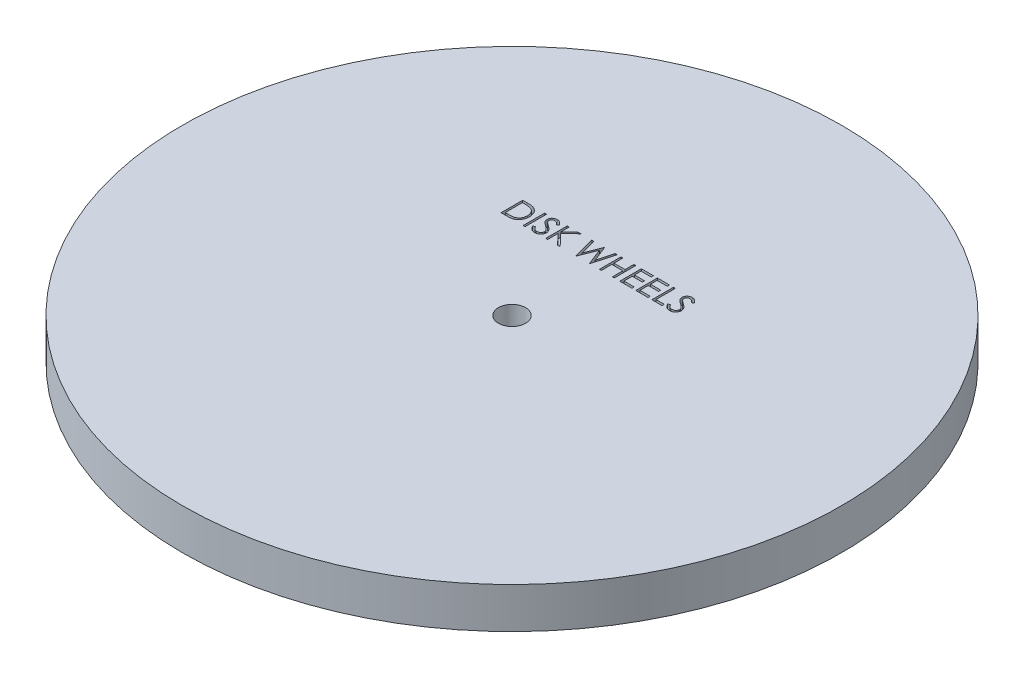
from build123d import *

# Parameters (mm, degrees)
SKETCH1_R           = 48.5
BOSS_EXTRUDE1_DEPTH = 6
SKETCH2_W           = 0.284935897
SKETCH2_H           = 3.175
CUT_EXTRUDE1_DEPTH  = 1
SKETCH3_R           = 2
CUT_EXTRUDE2_DEPTH  = 10


with BuildPart() as part:
    # Sketch1 → Boss-Extrude1 (new body)
    with BuildSketch(Plane(origin=(0, 0, 0), x_dir=(1, 0, 0), z_dir=(0, 1, 0))):
        with Locations(Location((0, 0, 0), (0, 0, 270))):
            Circle(SKETCH1_R)
    extrude(amount=BOSS_EXTRUDE1_DEPTH)

    # Sketch2 → Cut-Extrude1 (cut)
    # profile 1 of 10: a face of its own
    with BuildSketch(Plane(origin=(0, 6, 0), x_dir=(1, 0, 0), z_dir=(0, 1, 0))):
        with BuildLine():
            Line((-13.899118378, 12.298286199), (-13.899118378, 15.473286199))
            Line((-13.899118378, 15.473286199), (-13.258012609, 15.473286199))
            add(Edge.make_bspline(
                [(-13.258012609, 15.473286199), (-13.202251455, 15.472884725), (-13.094521197, 15.472109079), (-12.938844191, 15.467191102), (-12.794804635, 15.45849118), (-12.662876255, 15.445818824), (-12.54269687, 15.430258572), (-12.43460299, 15.410754634), (-12.338035689, 15.387723936), (-12.278645554, 15.368088421), (-12.250560686, 15.358803026)],
                knots=[0, 0, 0, 0, 1.314313732, 2.53924729, 3.670748893, 4.714932338, 5.66265055, 6.526160246, 7.303039223, 8, 8, 8, 8], degree=3))
            add(Edge.make_bspline(
                [(-12.250560686, 15.358803026), (-12.213826172, 15.344805171), (-12.141190162, 15.317126888), (-12.037769415, 15.2649151), (-11.940409979, 15.2057575), (-11.848589754, 15.139576111), (-11.764406148, 15.064497023), (-11.684570413, 14.983709524), (-11.612348485, 14.894275815), (-11.546210245, 14.798050648), (-11.486578611, 14.696167572), (-11.434745232, 14.588820723), (-11.391697681, 14.476555256), (-11.355962397, 14.359683372), (-11.327798824, 14.237948086), (-11.308583786, 14.11120765), (-11.295910103, 13.979962957), (-11.294636428, 13.890904694), (-11.293990173, 13.845717088)],
                knots=[0, 0, 0, 0, 0.984719456, 1.947108742, 2.898477687, 3.838006223, 4.779231079, 5.722358779, 6.681677486, 7.655904652, 8.64651281, 9.637519902, 10.640069247, 11.656948941, 12.698408672, 13.768548281, 14.867775369, 16, 16, 16, 16], degree=3))
            add(Edge.make_bspline(
                [(-11.293990173, 13.845717088), (-11.294560736, 13.806472965), (-11.295685091, 13.729138321), (-11.30578097, 13.61516408), (-11.320455203, 13.504571054), (-11.343173869, 13.397885883), (-11.370753291, 13.294173857), (-11.406099343, 13.194540321), (-11.446590115, 13.098071294), (-11.49380679, 13.006071155), (-11.545642189, 12.91890981), (-11.601269771, 12.836744867), (-11.660630201, 12.760748773), (-11.724289526, 12.690691389), (-11.791425097, 12.626678329), (-11.862476454, 12.568174858), (-11.937626936, 12.516325697), (-12.016539949, 12.469093392), (-12.10151758, 12.427890641), (-12.194169402, 12.393029132), (-12.294890542, 12.364139702), (-12.403433774, 12.340036104), (-12.519986643, 12.320915979), (-12.644663419, 12.308101323), (-12.777272546, 12.299435449), (-12.86833088, 12.298676721), (-12.915199107, 12.298286199)],
                knots=[0, 0, 0, 0, 1.105936401, 2.179363191, 3.223086493, 4.248585256, 5.251745608, 6.245858792, 7.225916811, 8.198733463, 9.158002045, 10.082870192, 10.993790845, 11.873723703, 12.748670949, 13.606408763, 14.465103618, 15.319838547, 16.196477973, 17.123216899, 18.106603292, 19.147568657, 20.255746949, 21.433717677, 22.679120308, 24, 24, 24, 24], degree=3))
            Line((-12.915199107, 12.298286199), (-13.899118378, 12.298286199))
        make_face()
        with BuildLine():
            Line((-13.61418248, 12.623927225), (-13.249744379, 12.623927225))
            add(Edge.make_bspline(
                [(-13.249744379, 12.623927225), (-13.1973765, 12.624152283), (-13.09665389, 12.624585154), (-12.951821279, 12.628383545), (-12.819487826, 12.63459016), (-12.699634742, 12.643276124), (-12.592329699, 12.654768367), (-12.49734844, 12.667581672), (-12.415002313, 12.683545074), (-12.365173467, 12.698014873), (-12.342147224, 12.704701463)],
                knots=[0, 0, 0, 0, 1.375205317, 2.645023457, 3.804390687, 4.853969522, 5.800190428, 6.637939096, 7.370582563, 8, 8, 8, 8], degree=3))
            add(Edge.make_bspline(
                [(-12.342147224, 12.704701463), (-12.313165496, 12.714908234), (-12.255894267, 12.735077987), (-12.173452139, 12.77186958), (-12.096565428, 12.8154506), (-12.023894191, 12.863894091), (-11.956469296, 12.918908679), (-11.893491705, 12.979298076), (-11.835088214, 13.045369622), (-11.781862234, 13.117041311), (-11.734229701, 13.193867054), (-11.6929808, 13.275091568), (-11.656829768, 13.359824889), (-11.628455616, 13.449368197), (-11.606216479, 13.542920985), (-11.590464227, 13.640489836), (-11.580653727, 13.742056527), (-11.579509413, 13.811137383), (-11.57892607, 13.846353106)],
                knots=[0, 0, 0, 0, 0.998632004, 1.973411704, 2.929992603, 3.868527914, 4.809262121, 5.754881198, 6.702106254, 7.672490631, 8.653608572, 9.636854334, 10.631411391, 11.644891563, 12.686317036, 13.754757253, 14.855430412, 16, 16, 16, 16], degree=3))
            add(Edge.make_bspline(
                [(-11.57892607, 13.846353106), (-11.579391695, 13.88348562), (-11.58030642, 13.956432773), (-11.59180383, 14.06346719), (-11.608605526, 14.166410351), (-11.632902156, 14.265269143), (-11.663863739, 14.360236434), (-11.702503164, 14.450786989), (-11.74665074, 14.53787712), (-11.799177338, 14.619496724), (-11.856704341, 14.69668833), (-11.920547131, 14.767404575), (-11.989691409, 14.831806547), (-12.063383023, 14.890897209), (-12.14369882, 14.942299258), (-12.228746811, 14.988279319), (-12.31977467, 15.027300877), (-12.383104758, 15.048055274), (-12.415289251, 15.058602705)],
                knots=[0, 0, 0, 0, 1.122418816, 2.205001699, 3.251619955, 4.274784885, 5.280384055, 6.268708349, 7.249350384, 8.229342522, 9.199999885, 10.157847722, 11.105861043, 12.055065948, 13.010012805, 13.98527497, 14.976112212, 16, 16, 16, 16], degree=3))
            add(Edge.make_bspline(
                [(-12.415289251, 15.058602705), (-12.441914934, 15.065965465), (-12.498528441, 15.081620712), (-12.590911383, 15.098698014), (-12.694883697, 15.113760667), (-12.810906998, 15.126513317), (-12.938849029, 15.135663958), (-13.078808188, 15.142532222), (-13.230844972, 15.147164667), (-13.336239128, 15.147480995), (-13.390940293, 15.147645173)],
                knots=[0, 0, 0, 0, 0.674548936, 1.434276114, 2.292660221, 3.240891867, 4.284742987, 5.42552168, 6.663806718, 8, 8, 8, 8], degree=3))
            Line((-13.390940293, 15.147645173), (-13.61418248, 15.147645173))
            Line((-13.61418248, 15.147645173), (-13.61418248, 12.623927225))
        make_face(mode=Mode.SUBTRACT)
    # profile 2 of 10: a face of its own
    with BuildSketch(Plane(origin=(0, 6, 0), x_dir=(1, 0, 0), z_dir=(0, 1, 0))):
        with Locations((-10.500240172, 13.885786199)):
            Rectangle(SKETCH2_W, SKETCH2_H)
    # profile 3 of 10: a face of its own
    with BuildSketch(Plane(origin=(0, 6, 0), x_dir=(1, 0, 0), z_dir=(0, 1, 0))):
        with BuildLine():
            Line((-9.869310686, 12.910771175), (-9.600911246, 13.071683635))
            add(Edge.make_bspline(
                [(-9.600911246, 13.071683635), (-9.575948274, 13.029896657), (-9.528120182, 12.94983442), (-9.448335735, 12.841650341), (-9.365665166, 12.749700384), (-9.27949627, 12.674519462), (-9.190355017, 12.6153294), (-9.097659483, 12.573417376), (-9.00172204, 12.547277169), (-8.936431502, 12.544102091), (-8.903835926, 12.542516968)],
                knots=[0, 0, 0, 0, 1.272034388, 2.437168799, 3.508375237, 4.49857839, 5.41946034, 6.295179144, 7.148887113, 8, 8, 8, 8], degree=3))
            add(Edge.make_bspline(
                [(-8.903835926, 12.542516968), (-8.87599856, 12.543292278), (-8.820810916, 12.544829332), (-8.739565167, 12.559598346), (-8.660660246, 12.58228792), (-8.58572241, 12.614782622), (-8.515785674, 12.65409682), (-8.454456743, 12.701582281), (-8.401437769, 12.754746481), (-8.358068073, 12.81405789), (-8.324794041, 12.877845589), (-8.299219807, 12.943319487), (-8.28502749, 13.011508117), (-8.282889578, 13.057419037), (-8.281810686, 13.080587882)],
                knots=[0, 0, 0, 0, 1.095163259, 2.171163733, 3.241058638, 4.321873601, 5.38011039, 6.391990106, 7.366004449, 8.327778327, 9.272591725, 10.192022065, 11.087607919, 12, 12, 12, 12], degree=3))
            add(Edge.make_bspline(
                [(-8.281810686, 13.080587882), (-8.283148096, 13.107022795), (-8.285866856, 13.160761112), (-8.308846127, 13.240045083), (-8.344995087, 13.3185062), (-8.378344056, 13.367039491), (-8.395657841, 13.392236519)],
                knots=[0, 0, 0, 0, 0.938893495, 1.908633276, 2.914225137, 4, 4, 4, 4], degree=3))
            add(Edge.make_bspline(
                [(-8.395657841, 13.392236519), (-8.409873327, 13.410421852), (-8.439716961, 13.448599684), (-8.491022704, 13.505427862), (-8.551226251, 13.564045999), (-8.618267333, 13.626692429), (-8.694588064, 13.690453502), (-8.777798023, 13.758369725), (-8.870021667, 13.827858299), (-8.934700496, 13.874460555), (-8.968073706, 13.898506551)],
                knots=[0, 0, 0, 0, 0.722233717, 1.516239348, 2.393582979, 3.351407094, 4.387010283, 5.505090956, 6.712668013, 8, 8, 8, 8], degree=3))
            add(Edge.make_bspline(
                [(-8.968073706, 13.898506551), (-9.001478332, 13.922299627), (-9.065345431, 13.967790177), (-9.154661431, 14.035303634), (-9.234530336, 14.097029145), (-9.304597159, 14.153547784), (-9.364831079, 14.204867218), (-9.415706744, 14.250494635), (-9.45592815, 14.291664008), (-9.478294284, 14.318371511), (-9.488336126, 14.330362521)],
                knots=[0, 0, 0, 0, 1.452282411, 2.77665338, 3.964542531, 5.026858415, 5.96415736, 6.766646006, 7.446254459, 8, 8, 8, 8], degree=3))
            add(Edge.make_bspline(
                [(-9.488336126, 14.330362521), (-9.502371935, 14.349050604), (-9.529975237, 14.385803229), (-9.566411542, 14.443247921), (-9.59738064, 14.502051883), (-9.621657898, 14.562373132), (-9.642101468, 14.623364817), (-9.655851877, 14.685822733), (-9.66446193, 14.749466623), (-9.66534366, 14.792296012), (-9.665785045, 14.813735918)],
                knots=[0, 0, 0, 0, 1.068054152, 2.10047183, 3.106115577, 4.101338837, 5.06977816, 6.043150881, 7.020423561, 8, 8, 8, 8], degree=3))
            add(Edge.make_bspline(
                [(-9.665785045, 14.813735918), (-9.664601034, 14.847327214), (-9.662258319, 14.913791815), (-9.64244585, 15.010884068), (-9.61117401, 15.103581746), (-9.567363648, 15.190967121), (-9.510887335, 15.270764832), (-9.445531344, 15.343892781), (-9.367688067, 15.405368566), (-9.282278187, 15.459082362), (-9.188791336, 15.501124737), (-9.090828159, 15.53283934), (-8.988232958, 15.550809167), (-8.918742971, 15.553387961), (-8.883483362, 15.554696455)],
                knots=[0, 0, 0, 0, 1.005424448, 1.989358655, 2.955360095, 3.929531133, 4.905563448, 5.876582895, 6.856512386, 7.866279853, 8.892233794, 9.918561126, 10.94386622, 12, 12, 12, 12], degree=3))
            add(Edge.make_bspline(
                [(-8.883483362, 15.554696455), (-8.846069071, 15.553405998), (-8.771663988, 15.55083969), (-8.662217913, 15.528526215), (-8.556843549, 15.491604891), (-8.472077159, 15.44970518), (-8.405735297, 15.407857396), (-8.355141461, 15.369739412), (-8.303872059, 15.325856278), (-8.251513538, 15.276091105), (-8.198953082, 15.219987266), (-8.145410379, 15.157928998), (-8.090760221, 15.090295551), (-8.05560312, 15.042013326), (-8.037579916, 15.017261559)],
                knots=[0, 0, 0, 0, 1.286793592, 2.559021753, 3.825965368, 5.121522368, 5.803751409, 6.523245864, 7.299691795, 8.125521123, 9.008227632, 9.944561021, 10.946284179, 12, 12, 12, 12], degree=3))
            Line((-8.037579916, 15.017261559), (-8.295167056, 14.822004148))
            add(Edge.make_bspline(
                [(-8.295167056, 14.822004148), (-8.310720866, 14.842041745), (-8.340673868, 14.880629474), (-8.386148474, 14.934669167), (-8.429009747, 14.984032688), (-8.47123761, 15.026908911), (-8.510601833, 15.065645846), (-8.548808007, 15.098810769), (-8.585306311, 15.12672863), (-8.631313794, 15.156522431), (-8.689114867, 15.186055831), (-8.761672268, 15.21104678), (-8.83749696, 15.226064586), (-8.889140269, 15.22805022), (-8.915284243, 15.22905543)],
                knots=[0, 0, 0, 0, 1.181633172, 2.275549214, 3.290209073, 4.226197932, 5.078386478, 5.862611352, 6.581680152, 7.217281963, 8.414376989, 9.595101626, 10.782541182, 12, 12, 12, 12], degree=3))
            add(Edge.make_bspline(
                [(-8.915284243, 15.22905543), (-8.948083374, 15.227956245), (-9.011333409, 15.22583657), (-9.101131694, 15.202686298), (-9.181952612, 15.16623561), (-9.251396725, 15.11514988), (-9.309215268, 15.054624408), (-9.351039506, 14.984975018), (-9.376212869, 14.908065267), (-9.379284709, 14.854415336), (-9.380849147, 14.827092289)],
                knots=[0, 0, 0, 0, 1.14458467, 2.207223713, 3.21896685, 4.227309161, 5.202851033, 6.127160689, 7.046193047, 8, 8, 8, 8], degree=3))
            add(Edge.make_bspline(
                [(-9.380849147, 14.827092289), (-9.380492525, 14.810082019), (-9.379778698, 14.776033664), (-9.369822989, 14.725731303), (-9.357032883, 14.675556016), (-9.336764924, 14.625733388), (-9.308783827, 14.575392076), (-9.272039846, 14.523665214), (-9.225763485, 14.470096878), (-9.190315052, 14.435255904), (-9.171599347, 14.416860918)],
                knots=[0, 0, 0, 0, 0.858281714, 1.717966888, 2.583508476, 3.4729293, 4.427298488, 5.488583878, 6.674047936, 8, 8, 8, 8], degree=3))
            add(Edge.make_bspline(
                [(-9.171599347, 14.416860918), (-9.164649388, 14.410658759), (-9.148137876, 14.395923849), (-9.117951858, 14.371800851), (-9.078089462, 14.342044051), (-9.029591608, 14.305225557), (-8.971564073, 14.262515945), (-8.904000475, 14.214461311), (-8.827653942, 14.159501644), (-8.773477633, 14.121077304), (-8.744831519, 14.100760157)],
                knots=[0, 0, 0, 0, 0.420754252, 0.999615792, 1.744751191, 2.668019286, 3.750313428, 4.999500688, 6.413464383, 8, 8, 8, 8], degree=3))
            add(Edge.make_bspline(
                [(-8.744831519, 14.100760157), (-8.710372869, 14.075685495), (-8.643648469, 14.027131888), (-8.548709093, 13.954183378), (-8.462626853, 13.882838617), (-8.385099518, 13.813553216), (-8.31536118, 13.746852732), (-8.254185533, 13.681934704), (-8.200949238, 13.61926422), (-8.143636661, 13.538916241), (-8.085073496, 13.440236257), (-8.034780129, 13.319333855), (-8.003067913, 13.197961478), (-7.998920896, 13.116384991), (-7.996874788, 13.076135758)],
                knots=[0, 0, 0, 0, 1.163667725, 2.253281268, 3.268753668, 4.215851969, 5.092017293, 5.902905408, 6.650798638, 7.335211899, 8.59617414, 9.77448103, 10.901945474, 12, 12, 12, 12], degree=3))
            add(Edge.make_bspline(
                [(-7.996874788, 13.076135758), (-7.997470906, 13.047671098), (-7.998651566, 12.991294543), (-8.012223252, 12.908513152), (-8.03210752, 12.828112292), (-8.062077011, 12.751085783), (-8.098655876, 12.676024462), (-8.145070972, 12.604897295), (-8.198871515, 12.536130062), (-8.260587859, 12.471556467), (-8.328120927, 12.412278132), (-8.399498279, 12.359546769), (-8.474836741, 12.315579076), (-8.553727614, 12.279700812), (-8.636189019, 12.251639692), (-8.722193223, 12.231308018), (-8.811881994, 12.218829623), (-8.872842431, 12.21753444), (-8.903835926, 12.216875942)],
                knots=[0, 0, 0, 0, 0.983748083, 1.948392443, 2.894712957, 3.844097841, 4.80183111, 5.778335162, 6.776009319, 7.81870978, 8.863265674, 9.881300176, 10.883814829, 11.87499822, 12.874611388, 13.892143829, 14.928324115, 16, 16, 16, 16], degree=3))
            add(Edge.make_bspline(
                [(-8.903835926, 12.216875942), (-8.927816559, 12.217339657), (-8.975475812, 12.218261247), (-9.045969414, 12.226408551), (-9.115038898, 12.237935709), (-9.181817568, 12.256236473), (-9.247165792, 12.278440588), (-9.310799354, 12.305780361), (-9.372749096, 12.338543822), (-9.433362189, 12.376004309), (-9.492484476, 12.419599548), (-9.549561422, 12.470375506), (-9.606465755, 12.526931786), (-9.661517893, 12.590804225), (-9.715831388, 12.660960915), (-9.768335374, 12.738058245), (-9.820116646, 12.821676273), (-9.852606392, 12.880518172), (-9.869310686, 12.910771175)],
                knots=[0, 0, 0, 0, 0.915332311, 1.819136955, 2.706846663, 3.586547465, 4.459518054, 5.340707479, 6.227863349, 7.133153174, 8.059268498, 9.028702269, 10.047606654, 11.120612155, 12.245963614, 13.433783089, 14.680604001, 16, 16, 16, 16], degree=3))
        make_face()
    # profile 4 of 10: a face of its own
    with BuildSketch(Plane(origin=(0, 6, 0), x_dir=(1, 0, 0), z_dir=(0, 1, 0))):
        Polygon((-7.345592737, 15.473286199), (-7.060656839, 15.473286199), (-7.060656839, 14.264216688), (-5.737104155, 15.473286199), (-5.330688891, 15.473286199), (-6.890840133, 14.048606712), (-5.208573506, 12.298286199), (-5.58827603, 12.298286199), (-7.060656839, 13.830452665), (-7.060656839, 12.298286199), (-7.345592737, 12.298286199), align=None)
    # profile 5 of 10: a face of its own
    with BuildSketch(Plane(origin=(0, 6, 0), x_dir=(1, 0, 0), z_dir=(0, 1, 0))):
        Polygon((-3.722836327, 15.473286199), (-3.428360165, 15.473286199), (-2.806970942, 13.144825662), (-1.882837328, 15.473286199), (-1.841496182, 15.473286199), (-0.934535045, 13.160726103), (-0.309965734, 15.473286199), (-0.01866966, 15.473286199), (-0.874749388, 12.298286199), (-0.915454516, 12.298286199), (-1.870752993, 14.726601503), (-2.837499788, 12.298286199), (-2.878204916, 12.298286199), align=None)
    # profile 6 of 10: a face of its own
    with BuildSketch(Plane(origin=(0, 6, 0), x_dir=(1, 0, 0), z_dir=(0, 1, 0))):
        Polygon((0.551202135, 15.473286199), (0.836138032, 15.473286199), (0.836138032, 14.170722096), (2.464343161, 14.170722096), (2.464343161, 15.473286199), (2.749279058, 15.473286199), (2.749279058, 12.298286199), (2.464343161, 12.298286199), (2.464343161, 13.845081071), (0.836138032, 13.845081071), (0.836138032, 12.298286199), (0.551202135, 12.298286199), align=None)
    # profile 7 of 10: a face of its own
    with BuildSketch(Plane(origin=(0, 6, 0), x_dir=(1, 0, 0), z_dir=(0, 1, 0))):
        Polygon((3.563381622, 15.473286199), (5.354407263, 15.473286199), (5.354407263, 15.147645173), (3.84831752, 15.147645173), (3.84831752, 14.170722096), (5.354407263, 14.170722096), (5.354407263, 13.845081071), (3.84831752, 13.845081071), (3.84831752, 12.623927225), (5.354407263, 12.623927225), (5.354407263, 12.298286199), (3.563381622, 12.298286199), align=None)
    # profile 8 of 10: a face of its own
    with BuildSketch(Plane(origin=(0, 6, 0), x_dir=(1, 0, 0), z_dir=(0, 1, 0))):
        Polygon((5.924279058, 15.473286199), (7.715304699, 15.473286199), (7.715304699, 15.147645173), (6.209214955, 15.147645173), (6.209214955, 14.170722096), (7.715304699, 14.170722096), (7.715304699, 13.845081071), (6.209214955, 13.845081071), (6.209214955, 12.623927225), (7.715304699, 12.623927225), (7.715304699, 12.298286199), (5.924279058, 12.298286199), align=None)
    # profile 9 of 10: a face of its own
    with BuildSketch(Plane(origin=(0, 6, 0), x_dir=(1, 0, 0), z_dir=(0, 1, 0))):
        Polygon((8.285176494, 15.473286199), (8.570112391, 15.473286199), (8.570112391, 12.623927225), (9.791266237, 12.623927225), (9.791266237, 12.298286199), (8.285176494, 12.298286199), align=None)
    # profile 10 of 10: a face of its own
    with BuildSketch(Plane(origin=(0, 6, 0), x_dir=(1, 0, 0), z_dir=(0, 1, 0))):
        with BuildLine():
            Line((9.994791879, 12.910771175), (10.263191318, 13.071683635))
            add(Edge.make_bspline(
                [(10.263191318, 13.071683635), (10.28815429, 13.029896657), (10.335982382, 12.94983442), (10.415766829, 12.841650341), (10.498437398, 12.749700384), (10.584606294, 12.674519462), (10.673747547, 12.6153294), (10.766443081, 12.573417376), (10.862380524, 12.547277169), (10.927671062, 12.544102091), (10.960266638, 12.542516968)],
                knots=[0, 0, 0, 0, 1.272034388, 2.437168799, 3.508375237, 4.49857839, 5.41946034, 6.295179144, 7.148887113, 8, 8, 8, 8], degree=3))
            add(Edge.make_bspline(
                [(10.960266638, 12.542516968), (10.988104004, 12.543292278), (11.043291649, 12.544829332), (11.124537398, 12.559598346), (11.203442318, 12.58228792), (11.278380154, 12.614782622), (11.34831689, 12.65409682), (11.409645821, 12.701582281), (11.462664795, 12.754746481), (11.506034492, 12.81405789), (11.539308524, 12.877845589), (11.564882757, 12.943319487), (11.579075074, 13.011508117), (11.581212986, 13.057419037), (11.582291879, 13.080587882)],
                knots=[0, 0, 0, 0, 1.095163259, 2.171163733, 3.241058638, 4.321873601, 5.38011039, 6.391990106, 7.366004449, 8.327778327, 9.272591725, 10.192022065, 11.087607919, 12, 12, 12, 12], degree=3))
            add(Edge.make_bspline(
                [(11.582291879, 13.080587882), (11.580954468, 13.107022795), (11.578235708, 13.160761112), (11.555256437, 13.240045083), (11.519107477, 13.3185062), (11.485758508, 13.367039491), (11.468444723, 13.392236519)],
                knots=[0, 0, 0, 0, 0.938893495, 1.908633276, 2.914225137, 4, 4, 4, 4], degree=3))
            add(Edge.make_bspline(
                [(11.468444723, 13.392236519), (11.454229237, 13.410421852), (11.424385603, 13.448599684), (11.37307986, 13.505427862), (11.312876313, 13.564045999), (11.245835231, 13.626692429), (11.169514501, 13.690453502), (11.086304541, 13.758369725), (10.994080898, 13.827858299), (10.929402069, 13.874460555), (10.896028858, 13.898506551)],
                knots=[0, 0, 0, 0, 0.722233717, 1.516239348, 2.393582979, 3.351407094, 4.387010283, 5.505090956, 6.712668013, 8, 8, 8, 8], degree=3))
            add(Edge.make_bspline(
                [(10.896028858, 13.898506551), (10.862624233, 13.922299627), (10.798757133, 13.967790177), (10.709441133, 14.035303634), (10.629572228, 14.097029145), (10.559505406, 14.153547784), (10.499271486, 14.204867218), (10.44839582, 14.250494635), (10.408174414, 14.291664008), (10.385808281, 14.318371511), (10.375766438, 14.330362521)],
                knots=[0, 0, 0, 0, 1.452282411, 2.77665338, 3.964542531, 5.026858415, 5.96415736, 6.766646006, 7.446254459, 8, 8, 8, 8], degree=3))
            add(Edge.make_bspline(
                [(10.375766438, 14.330362521), (10.361730629, 14.349050604), (10.334127327, 14.385803229), (10.297691022, 14.443247921), (10.266721924, 14.502051883), (10.242444666, 14.562373132), (10.222001096, 14.623364817), (10.208250687, 14.685822733), (10.199640635, 14.749466623), (10.198758904, 14.792296012), (10.19831752, 14.813735918)],
                knots=[0, 0, 0, 0, 1.068054152, 2.10047183, 3.106115577, 4.101338837, 5.06977816, 6.043150881, 7.020423561, 8, 8, 8, 8], degree=3))
            add(Edge.make_bspline(
                [(10.19831752, 14.813735918), (10.199501531, 14.847327214), (10.201844245, 14.913791815), (10.221656714, 15.010884068), (10.252928554, 15.103581746), (10.296738916, 15.190967121), (10.353215229, 15.270764832), (10.41857122, 15.343892781), (10.496414497, 15.405368566), (10.581824377, 15.459082362), (10.675311229, 15.501124737), (10.773274405, 15.53283934), (10.875869606, 15.550809167), (10.945359593, 15.553387961), (10.980619202, 15.554696455)],
                knots=[0, 0, 0, 0, 1.005424448, 1.989358655, 2.955360095, 3.929531133, 4.905563448, 5.876582895, 6.856512386, 7.866279853, 8.892233794, 9.918561126, 10.94386622, 12, 12, 12, 12], degree=3))
            add(Edge.make_bspline(
                [(10.980619202, 15.554696455), (11.018033493, 15.553405998), (11.092438577, 15.55083969), (11.201884651, 15.528526215), (11.307259015, 15.491604891), (11.392025405, 15.44970518), (11.458367267, 15.407857396), (11.508961103, 15.369739412), (11.560230505, 15.325856278), (11.612589026, 15.276091105), (11.665149482, 15.219987266), (11.718692185, 15.157928998), (11.773342343, 15.090295551), (11.808499445, 15.042013326), (11.826522648, 15.017261559)],
                knots=[0, 0, 0, 0, 1.286793592, 2.559021753, 3.825965368, 5.121522368, 5.803751409, 6.523245864, 7.299691795, 8.125521123, 9.008227632, 9.944561021, 10.946284179, 12, 12, 12, 12], degree=3))
            Line((11.826522648, 15.017261559), (11.568935508, 14.822004148))
            add(Edge.make_bspline(
                [(11.568935508, 14.822004148), (11.553381698, 14.842041745), (11.523428696, 14.880629474), (11.47795409, 14.934669167), (11.435092817, 14.984032688), (11.392864954, 15.026908911), (11.353500731, 15.065645846), (11.315294557, 15.098810769), (11.278796253, 15.12672863), (11.23278877, 15.156522431), (11.174987697, 15.186055831), (11.102430296, 15.21104678), (11.026605604, 15.226064586), (10.974962295, 15.22805022), (10.948818321, 15.22905543)],
                knots=[0, 0, 0, 0, 1.181633172, 2.275549214, 3.290209073, 4.226197932, 5.078386478, 5.862611352, 6.581680152, 7.217281963, 8.414376989, 9.595101626, 10.782541182, 12, 12, 12, 12], degree=3))
            add(Edge.make_bspline(
                [(10.948818321, 15.22905543), (10.91601919, 15.227956245), (10.852769155, 15.22583657), (10.76297087, 15.202686298), (10.682149952, 15.16623561), (10.612705839, 15.11514988), (10.554887296, 15.054624408), (10.513063058, 14.984975018), (10.487889695, 14.908065267), (10.484817855, 14.854415336), (10.483253417, 14.827092289)],
                knots=[0, 0, 0, 0, 1.14458467, 2.207223713, 3.21896685, 4.227309161, 5.202851033, 6.127160689, 7.046193047, 8, 8, 8, 8], degree=3))
            add(Edge.make_bspline(
                [(10.483253417, 14.827092289), (10.483610039, 14.810082019), (10.484323866, 14.776033664), (10.494279576, 14.725731303), (10.507069681, 14.675556016), (10.52733764, 14.625733388), (10.555318737, 14.575392076), (10.592062718, 14.523665214), (10.638339079, 14.470096878), (10.673787512, 14.435255904), (10.692503217, 14.416860918)],
                knots=[0, 0, 0, 0, 0.858281714, 1.717966888, 2.583508476, 3.4729293, 4.427298488, 5.488583878, 6.674047936, 8, 8, 8, 8], degree=3))
            add(Edge.make_bspline(
                [(10.692503217, 14.416860918), (10.699453176, 14.410658759), (10.715964688, 14.395923849), (10.746150707, 14.371800851), (10.786013102, 14.342044051), (10.834510956, 14.305225557), (10.892538491, 14.262515945), (10.960102089, 14.214461311), (11.036448622, 14.159501644), (11.090624931, 14.121077304), (11.119271045, 14.100760157)],
                knots=[0, 0, 0, 0, 0.420754252, 0.999615792, 1.744751191, 2.668019286, 3.750313428, 4.999500688, 6.413464383, 8, 8, 8, 8], degree=3))
            add(Edge.make_bspline(
                [(11.119271045, 14.100760157), (11.153729695, 14.075685495), (11.220454095, 14.027131888), (11.315393471, 13.954183378), (11.401475711, 13.882838617), (11.479003046, 13.813553216), (11.548741384, 13.746852732), (11.609917031, 13.681934704), (11.663153326, 13.61926422), (11.720465903, 13.538916241), (11.779029068, 13.440236257), (11.829322436, 13.319333855), (11.861034651, 13.197961478), (11.865181668, 13.116384991), (11.867227776, 13.076135758)],
                knots=[0, 0, 0, 0, 1.163667725, 2.253281268, 3.268753668, 4.215851969, 5.092017293, 5.902905408, 6.650798638, 7.335211899, 8.59617414, 9.77448103, 10.901945474, 12, 12, 12, 12], degree=3))
            add(Edge.make_bspline(
                [(11.867227776, 13.076135758), (11.866631658, 13.047671098), (11.865450998, 12.991294543), (11.851879312, 12.908513152), (11.831995044, 12.828112292), (11.802025553, 12.751085783), (11.765446688, 12.676024462), (11.719031592, 12.604897295), (11.665231049, 12.536130062), (11.603514705, 12.471556467), (11.535981637, 12.412278132), (11.464604285, 12.359546769), (11.389265823, 12.315579076), (11.31037495, 12.279700812), (11.227913545, 12.251639692), (11.141909341, 12.231308018), (11.05222057, 12.218829623), (10.991260133, 12.21753444), (10.960266638, 12.216875942)],
                knots=[0, 0, 0, 0, 0.983748083, 1.948392443, 2.894712957, 3.844097841, 4.80183111, 5.778335162, 6.776009319, 7.81870978, 8.863265674, 9.881300176, 10.883814829, 11.87499822, 12.874611388, 13.892143829, 14.928324115, 16, 16, 16, 16], degree=3))
            add(Edge.make_bspline(
                [(10.960266638, 12.216875942), (10.936286006, 12.217339657), (10.888626752, 12.218261247), (10.81813315, 12.226408551), (10.749063666, 12.237935709), (10.682284996, 12.256236473), (10.616936772, 12.278440588), (10.55330321, 12.305780361), (10.491353468, 12.338543822), (10.430740375, 12.376004309), (10.371618088, 12.419599548), (10.314541142, 12.470375506), (10.257636809, 12.526931786), (10.202584671, 12.590804225), (10.148271176, 12.660960915), (10.09576719, 12.738058245), (10.043985918, 12.821676273), (10.011496172, 12.880518172), (9.994791879, 12.910771175)],
                knots=[0, 0, 0, 0, 0.915332311, 1.819136955, 2.706846663, 3.586547465, 4.459518054, 5.340707479, 6.227863349, 7.133153174, 8.059268498, 9.028702269, 10.047606654, 11.120612155, 12.245963614, 13.433783089, 14.680604001, 16, 16, 16, 16], degree=3))
        make_face()
    extrude(amount=-CUT_EXTRUDE1_DEPTH, mode=Mode.SUBTRACT)

    # Sketch3 → Cut-Extrude2 (cut)
    with BuildSketch(Plane(origin=(0, 6, 0), x_dir=(1, 0, 0), z_dir=(0, 1, 0))):
        with Locations(Location((0, 0, 0), (0, 0, 270))):
            Circle(SKETCH3_R)
    extrude(amount=-CUT_EXTRUDE2_DEPTH, mode=Mode.SUBTRACT)


solid = part.part
